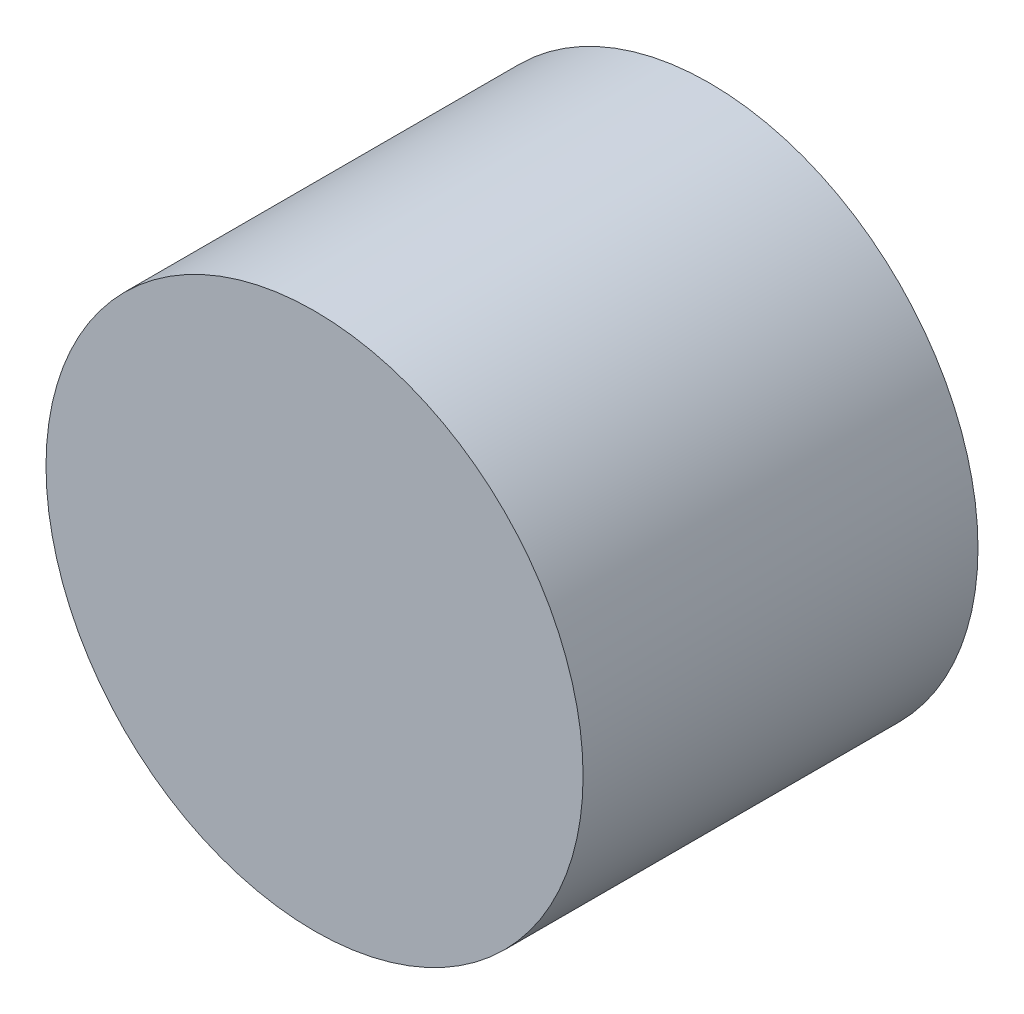
from build123d import *

# Parameters (mm, degrees)
SKETCH_1_R             = 17
EXTRUDE_1_DEPTH        = 25
HOLE_WIZARD_M5_1_D     = 4.2
HOLE_WIZARD_M5_1_DEPTH = 4
HOLE_WIZARD_M5_1_TIP   = 1.2618073


with BuildPart() as part:
    # 草图1 → 凸台-拉伸1 (new body)
    with BuildSketch(Plane.XY):
        Circle(SKETCH_1_R)
    extrude(amount=EXTRUDE_1_DEPTH)

    # M5 螺纹孔1
    with Locations(Plane(origin=(0, 0, 0), x_dir=(-1, 0, 0), z_dir=(0, 0, -1))):
        with Locations((0, 0)):
            Hole(HOLE_WIZARD_M5_1_D / 2, depth=HOLE_WIZARD_M5_1_DEPTH)
            with Locations((0, 0, -(HOLE_WIZARD_M5_1_DEPTH + HOLE_WIZARD_M5_1_TIP / 2))):  # 118° drill point
                Cone(0, HOLE_WIZARD_M5_1_D / 2, HOLE_WIZARD_M5_1_TIP, mode=Mode.SUBTRACT)


solid = part.part
